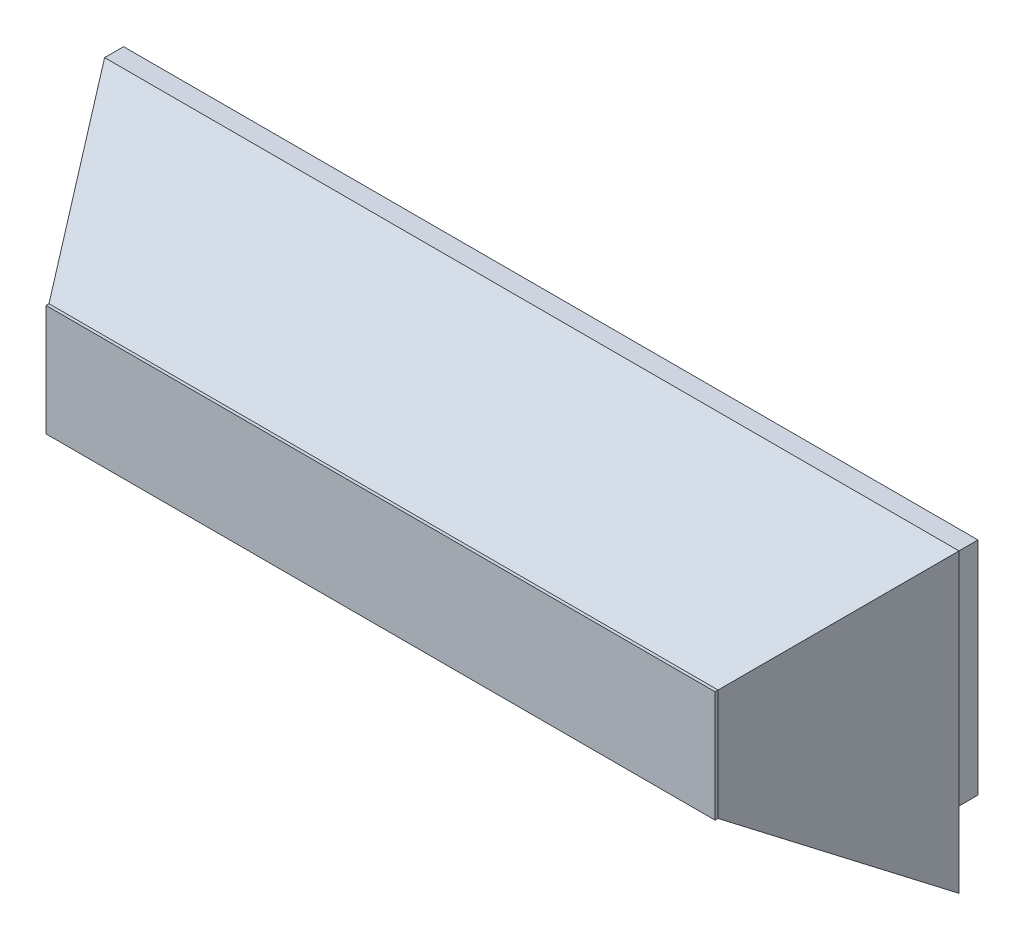
from build123d import *

# Parameters (mm, degrees)
SKETCH1_W           = 288.1
SKETCH1_H           = 100
BOSS_EXTRUDE1_DEPTH = 50
BOSS_EXTRUDE1_TAPER = 32
SKETCH2_W           = 225.613064809
SKETCH2_H           = 37.513064809
CUT_EXTRUDE1_DEPTH  = 50
CUT_EXTRUDE1_TAPER  = -26.5
BOSS_EXTRUDE2_DEPTH = 6.4
SKETCH5_W           = 225.613064809
SKETCH5_H           = 37.513064809
BOSS_EXTRUDE3_DEPTH = 1


with BuildPart() as part:
    # Sketch1 → Boss-Extrude1 (new body)
    with BuildSketch(Plane.XY):
        with Locations((22.537303057, -7.618243287)):
            Rectangle(SKETCH1_W, SKETCH1_H)
    extrude(amount=BOSS_EXTRUDE1_DEPTH, taper=BOSS_EXTRUDE1_TAPER)

    # Sketch2 → Cut-Extrude1 (cut)
    with BuildSketch(Plane.XY.offset(50)):
        with Locations((22.537303058, -7.618243286)):
            Rectangle(SKETCH2_W, SKETCH2_H)
    extrude(amount=-CUT_EXTRUDE1_DEPTH, taper=CUT_EXTRUDE1_TAPER, mode=Mode.SUBTRACT)

    # Sketch3 → Boss-Extrude2 (add)
    with BuildSketch(Plane(origin=(0, 0, 0), x_dir=(-1, 0, 0), z_dir=(0, 0, -1))):
        Polygon((-166.587303057, 42.381756713), (117.996036654, 42.381756713), (121.512696943, 42.381756713), (121.512696943, -32.118243287), (115.112696943, -32.118243287), (115.112696943, 32.465096425), (111.596036654, 32.465096425), (-160.187303057, 32.465096425), (-160.187303057, -7.618243287), (-160.187303057, -32.118243287), (-166.587303057, -32.118243287), (-166.587303057, -7.618243287), (-166.587303057, 32.465096425), align=None)
    extrude(amount=BOSS_EXTRUDE2_DEPTH)


with BuildPart() as body_2:
    # Sketch5 → Boss-Extrude3 (new body)
    with BuildSketch(Plane.XY.offset(50)):
        with Locations((22.537303058, -7.618243286)):
            Rectangle(SKETCH5_W, SKETCH5_H)
    extrude(amount=BOSS_EXTRUDE3_DEPTH)


solid = Compound([part.part, body_2.part])
